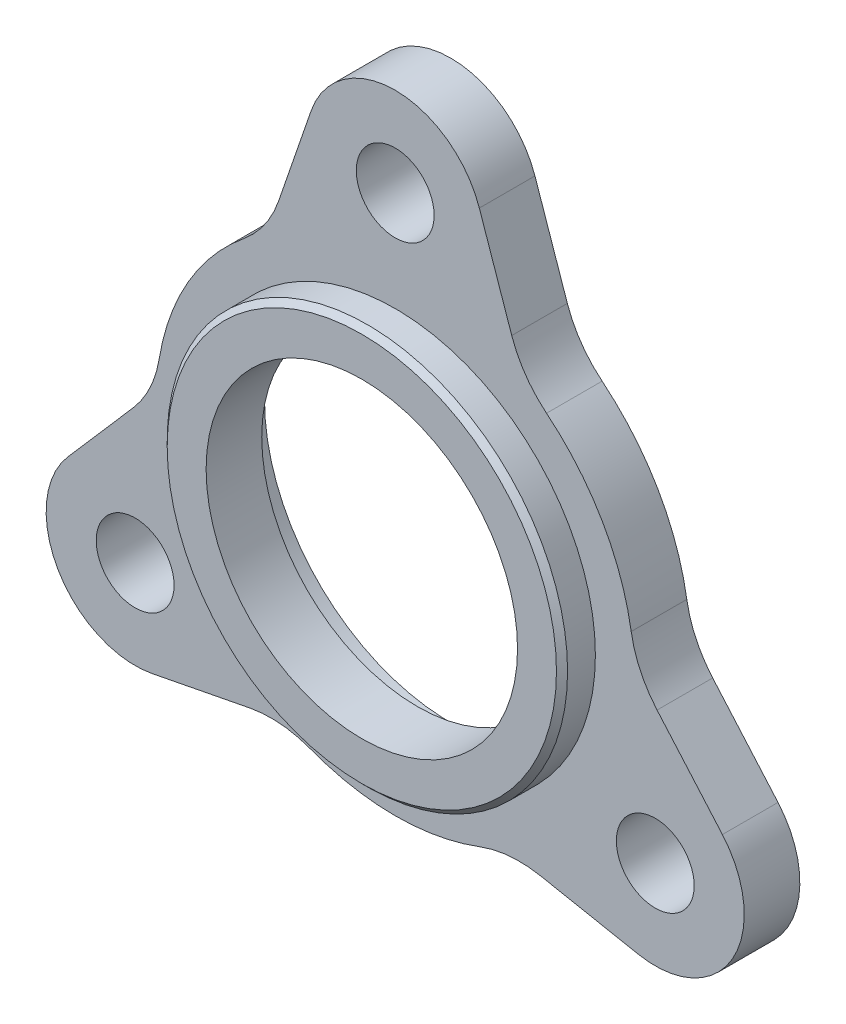
from build123d import *

# Parameters (mm, degrees)
SKETCH_1_R          = 3.5
EXTRUDE_1_DEPTH     = 5
FILLET_1_R          = 10
SKETCH_2_R          = 18
EXTRUDE_2_DEPTH     = 3
SKETCH_3_R          = 14
CUT_EXTRUDE_1_DEPTH = 32
SKETCH_4_R          = 16.75
CUT_EXTRUDE_2_DEPTH = 3
CHAMFER_1_SIZE      = 0.5


with BuildPart() as part:
    # 草图1 → 凸台-拉伸1 (new body)
    with BuildSketch(Plane.XY):
        with BuildLine():
            Line((-11.5, 18.165902125), (-7.564716302, 29.602895938))
            ThreePointArc((-7.564716302, 29.602895938), (0, 35), (7.564716302, 29.602895938))
            Line((7.564716302, 29.602895938), (11.5, 18.165902125))
            ThreePointArc((11.5, 18.165902125), (18.619546181, 10.75), (21.482132723, 0.876341081))
            Line((21.482132723, 0.876341081), (29.419218059, -8.250211479))
            ThreePointArc((29.419218059, -8.250211479), (30.310889132, -17.5), (21.854501757, -21.352684459))
            Line((21.854501757, -21.352684459), (9.982132723, -19.042243206))
            ThreePointArc((9.982132723, -19.042243206), (0, -21.5), (-9.982132723, -19.042243206))
            Line((-9.982132723, -19.042243206), (-21.854501757, -21.352684459))
            ThreePointArc((-21.854501757, -21.352684459), (-30.310889132, -17.5), (-29.419218059, -8.250211479))
            Line((-29.419218059, -8.250211479), (-21.482132723, 0.876341081))
            ThreePointArc((-21.482132723, 0.876341081), (-18.619546181, 10.75), (-11.5, 18.165902125))
        make_face()
        with Locations((0, 27)):
            Circle(SKETCH_1_R, mode=Mode.SUBTRACT)
        with Locations((23.382685902, -13.5)):
            Circle(SKETCH_1_R, mode=Mode.SUBTRACT)
        with Locations((-23.382685902, -13.5)):
            Circle(SKETCH_1_R, mode=Mode.SUBTRACT)
    extrude(amount=EXTRUDE_1_DEPTH)

    # 圆角1
    fillet_1_edges = [part.edges().sort_by_distance(p)[0] for p in [
        (21.482132723, 0.876341081, 2.5),
        (9.982132723, -19.042243206, 2.5),
        (-9.982132723, -19.042243206, 2.5),
        (-21.482132723, 0.876341081, 2.5),
        (-11.5, 18.165902125, 2.5),
        (11.5, 18.165902125, 2.5),
    ]]
    fillet(fillet_1_edges, radius=FILLET_1_R)

    # 草图2 → 凸台-拉伸2 (add)
    with BuildSketch(Plane.XY.offset(5)):
        Circle(SKETCH_2_R)
    extrude(amount=EXTRUDE_2_DEPTH)

    # 草图3 → 切除-拉伸1 (cut)
    with BuildSketch(Plane.XY.offset(8)):
        Circle(SKETCH_3_R)
    extrude(amount=-CUT_EXTRUDE_1_DEPTH, mode=Mode.SUBTRACT)

    # 草图4 → 切除-拉伸2 (cut)
    with BuildSketch(Plane(origin=(0, 0, 0), x_dir=(-1, 0, 0), z_dir=(0, 0, -1))):
        Circle(SKETCH_4_R)
    extrude(amount=-CUT_EXTRUDE_2_DEPTH, mode=Mode.SUBTRACT)

    # 倒角1
    chamfer_1_edges = [part.edges().sort_by_distance(p)[0] for p in [
        (-18, 0, 8),
    ]]
    chamfer(chamfer_1_edges, length=CHAMFER_1_SIZE)


solid = part.part
